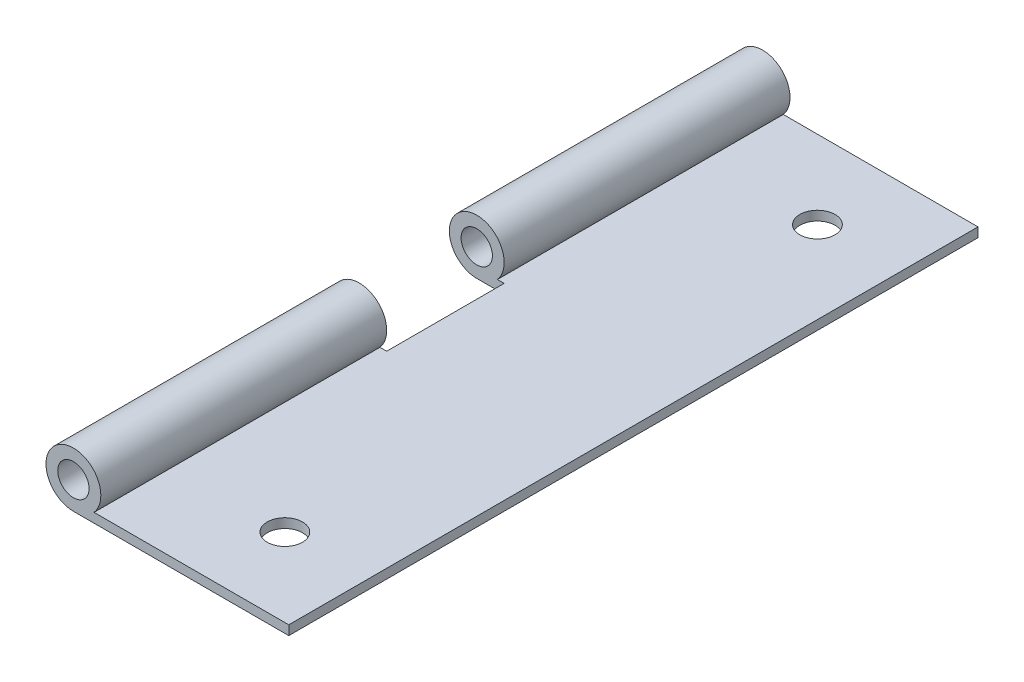
from build123d import *

# Parameters (mm, degrees)
SKETCH1_W           = 24
SKETCH1_H           = 88
BOSS_EXTRUDE1_DEPTH = 1.2
BOSS_EXTRUDE2_START = 7.5
SKETCH2_R           = 2
BOSS_EXTRUDE2_DEPTH = 36.5
SKETCH4_R           = 2.25
CUT_EXTRUDE2_DEPTH  = 49.276702456


with BuildPart() as part:
    # Sketch1 → Boss-Extrude1 (new body)
    with BuildSketch(Plane(origin=(0, 0, 0), x_dir=(1, 0, 0), z_dir=(0, 1, 0))):
        Rectangle(SKETCH1_W, SKETCH1_H)
    extrude(amount=BOSS_EXTRUDE1_DEPTH)

    # Sketch2 → Boss-Extrude2 (add)
    with BuildSketch(Plane.XY.offset(BOSS_EXTRUDE2_START)):
        with BuildLine():
            Line((-12, 0), (-15.5, 0))
            ThreePointArc((-15.5, 0), (-16.949137675, 6.685906464), (-12.861818808, 1.2))
            Line((-12.861818808, 1.2), (-12, 1.2))
            Line((-12, 1.2), (-12, 0))
        make_face()
        with Locations(Location((-15.5, 3.5, 0), (0, 0, 180))):
            Circle(SKETCH2_R, mode=Mode.SUBTRACT)
    extrude(amount=BOSS_EXTRUDE2_DEPTH)

    # Mirror4: part across plane


with BuildPart() as part_1:
    add(part.part)
    add(part.part.mirror(Plane.XY))

    # Sketch4 → Cut-Extrude2 (cut, through all)
    with BuildSketch(Plane(origin=(0, 1.2, 0), x_dir=(1, 0, 0), z_dir=(0, 1, 0))):
        with Locations(Location((1.5, 34, 0), (0, 0, 270))):
            Circle(SKETCH4_R)
        with Locations(Location((1.5, -34, 0), (0, 0, 90))):
            Circle(SKETCH4_R)
    extrude(amount=-CUT_EXTRUDE2_DEPTH, mode=Mode.SUBTRACT)


solid = part_1.part
